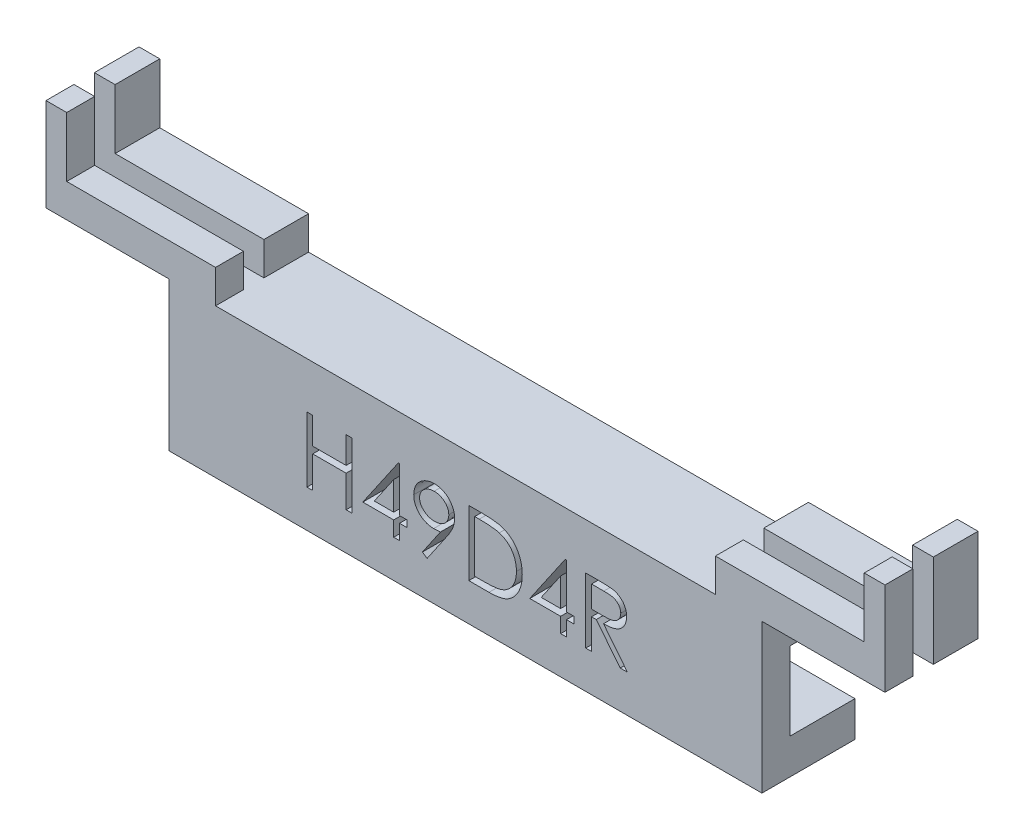
from build123d import *

# Parameters (mm, degrees)
BOSS_EXTRUDE1_DEPTH   = 5
BOSS_EXTRUDE1_2_DEPTH = 5
SKETCH4_W             = 31.87087044
SKETCH4_H             = 8
BOSS_EXTRUDE2_DEPTH   = 5
SKETCH5_W             = 32.67615924
SKETCH5_H             = 4.2
CUT_EXTRUDE1_DEPTH    = 3.5
SKETCH6_W             = 45.1
SKETCH6_H             = 1.1
CUT_EXTRUDE2_DEPTH    = 5
CUT_EXTRUDE4_DEPTH    = 10


with BuildPart() as part:
    # Sketch2 → Boss-Extrude1 (new body)
    with BuildSketch(Plane.XY):
        Polygon((21.435301444, 2.5), (21.435301444, -0.71006712), (13.43543522, -0.71006712), (13.43543522, -2.5), (22.55, -2.5), (22.55, 2.5), align=None)
    extrude(amount=-BOSS_EXTRUDE1_DEPTH)



with BuildPart() as body_2:
    # Sketch2 → Boss-Extrude1 2 (new body)
    with BuildSketch(Plane.XY):
        Polygon((-22.55, 2.5), (-21.435301444, 2.5), (-21.435301444, -0.71006712), (-13.43543522, -0.71006712), (-13.43543522, -2.5), (-22.55, -2.5), align=None)
    extrude(amount=-BOSS_EXTRUDE1_2_DEPTH)


with BuildPart() as part_1:
    add(part.part)

    add(body_2.part)  # Boss-Extrude2 merges body 2
    # Sketch4 → Boss-Extrude2 (add)
    with BuildSketch(Plane.XY):
        with Locations((0, -6.5)):
            Rectangle(SKETCH4_W, SKETCH4_H)
    extrude(amount=-BOSS_EXTRUDE2_DEPTH)

    # Sketch5 → Cut-Extrude1 (cut)
    with BuildSketch(Plane(origin=(0, 0, -5), x_dir=(-1, 0, 0), z_dir=(0, 0, -1))):
        with Locations((0, -6.5)):
            Rectangle(SKETCH5_W, SKETCH5_H)
    extrude(amount=-CUT_EXTRUDE1_DEPTH, mode=Mode.SUBTRACT)

    # Sketch6 → Cut-Extrude2 (cut)
    with BuildSketch(Plane(origin=(0, 2.5, 0), x_dir=(1, 0, 0), z_dir=(0, 1, 0))):
        with Locations((0, 2.05)):
            Rectangle(SKETCH6_W, SKETCH6_H)
    extrude(amount=-CUT_EXTRUDE2_DEPTH, mode=Mode.SUBTRACT)

    # Sketch10 → Cut-Extrude4 (cut)
    # profile 1 of 6: a face of its own
    with BuildSketch(Plane.XY):
        Polygon((-8.525641026, -4.985034776), (-8.211538462, -4.985034776), (-8.211538462, -6.420932211), (-6.416666667, -6.420932211), (-6.416666667, -4.985034776), (-6.102564103, -4.985034776), (-6.102564103, -8.485034776), (-6.416666667, -8.485034776), (-6.416666667, -6.77990657), (-8.211538462, -6.77990657), (-8.211538462, -8.485034776), (-8.525641026, -8.485034776), align=None)
    # profile 2 of 6: a face of its own
    with BuildSketch(Plane.XY):
        Polygon((-3.608673878, -4.895291186), (-3.544871795, -4.895291186), (-3.544871795, -7.318368109), (-3.141025641, -7.318368109), (-3.141025641, -7.677342468), (-3.544871795, -7.677342468), (-3.544871795, -8.485034776), (-3.858974359, -8.485034776), (-3.858974359, -7.677342468), (-5.519230769, -7.677342468), align=None)
        Polygon((-3.858974359, -7.318368109), (-3.858974359, -5.798336058), (-4.90224359, -7.318368109), align=None, mode=Mode.SUBTRACT)
    # profile 3 of 6: a face of its own
    with BuildSketch(Plane.XY):
        with BuildLine():
            Line((-2.064102564, -8.574778365), (-2.315104167, -8.400199038))
            Line((-2.315104167, -8.400199038), (-1.341947115, -6.977622917))
            add(Edge.make_bspline(
                [(-1.341947115, -6.977622917), (-1.404037851, -6.98521598), (-1.526297971, -7.000167145), (-1.649435073, -7.0029138), (-1.710036058, -7.004265545)],
                knots=[0, 0, 0, 0, 1.015715272, 2, 2, 2, 2], degree=3))
            add(Edge.make_bspline(
                [(-1.710036058, -7.004265545), (-1.746778105, -7.003324468), (-1.818899532, -7.001477218), (-1.924931185, -6.986835409), (-2.026816745, -6.964285281), (-2.124286101, -6.930636526), (-2.217705606, -6.888818317), (-2.30687132, -6.836961304), (-2.39166321, -6.775955012), (-2.47117062, -6.706122021), (-2.543482359, -6.629443968), (-2.607905657, -6.548288325), (-2.661446789, -6.461712355), (-2.705923374, -6.371482135), (-2.739653828, -6.276300784), (-2.764216365, -6.177251384), (-2.77933872, -6.073639742), (-2.781137815, -6.003114611), (-2.782051282, -5.96730641)],
                knots=[0, 0, 0, 0, 1.060718605, 2.082097864, 3.085795603, 4.069760067, 5.054557537, 6.03741023, 7.043284206, 8.066802108, 9.088538119, 10.083643548, 11.053783639, 12.022749082, 12.983451788, 13.964007469, 14.966251758, 16, 16, 16, 16], degree=3))
            add(Edge.make_bspline(
                [(-2.782051282, -5.96730641), (-2.780316847, -5.918337757), (-2.776912504, -5.822222226), (-2.749513986, -5.681788457), (-2.704453647, -5.549001913), (-2.64162527, -5.424211719), (-2.562490549, -5.30921298), (-2.467381959, -5.205604371), (-2.356877995, -5.114859517), (-2.233495975, -5.03685544), (-2.100142955, -4.974120442), (-1.960474297, -4.927881142), (-1.815560176, -4.900682394), (-1.717392506, -4.897096533), (-1.66796875, -4.895291186)],
                knots=[0, 0, 0, 0, 1.022988612, 2.007919123, 2.978103895, 3.94594894, 4.918897164, 5.887013414, 6.875921846, 7.89917871, 8.930658928, 9.948724884, 10.967259574, 12, 12, 12, 12], degree=3))
            add(Edge.make_bspline(
                [(-1.66796875, -4.895291186), (-1.61948033, -4.897121349), (-1.523671784, -4.900737579), (-1.382782777, -4.927221548), (-1.24784176, -4.97185822), (-1.119596773, -5.033542784), (-1.000857361, -5.110863692), (-0.89408155, -5.202998216), (-0.801706011, -5.310003743), (-0.72388213, -5.429292233), (-0.66141209, -5.557459214), (-0.616339807, -5.691243137), (-0.588594168, -5.829681858), (-0.585097841, -5.923476332), (-0.583333333, -5.970812019)],
                knots=[0, 0, 0, 0, 1.026385292, 2.028040595, 3.023318987, 4.028184125, 5.03290303, 6.015178782, 7.004435299, 8.016004309, 9.023023918, 10.015172535, 10.998308025, 12, 12, 12, 12], degree=3))
            add(Edge.make_bspline(
                [(-0.583333333, -5.970812019), (-0.584511742, -6.007555786), (-0.58690185, -6.082081327), (-0.603638157, -6.19531167), (-0.632058342, -6.310762899), (-0.664310041, -6.408484495), (-0.695442209, -6.489192945), (-0.72474334, -6.552944525), (-0.757255494, -6.620045788), (-0.795174259, -6.689793126), (-0.835936556, -6.763075661), (-0.881995833, -6.839158377), (-0.932301404, -6.91814337), (-0.968131124, -6.971390458), (-0.986478365, -6.99865657)],
                knots=[0, 0, 0, 0, 1.179839688, 2.393009684, 3.667231171, 4.993948276, 5.694988576, 6.444077775, 7.246288328, 8.089075292, 8.993003841, 9.939041771, 10.944649915, 12, 12, 12, 12], degree=3))
            Line((-0.986478365, -6.99865657), (-2.064102564, -8.574778365))
        make_face()
        with BuildLine():
            add(Edge.make_bspline(
                [(-1.651842949, -6.645291186), (-1.624008935, -6.644530802), (-1.569825572, -6.643050593), (-1.490448273, -6.634041351), (-1.415524069, -6.618067365), (-1.34485282, -6.595147653), (-1.277725918, -6.567490984), (-1.21520959, -6.532278998), (-1.157251514, -6.490262363), (-1.103463587, -6.443052348), (-1.055699588, -6.390601764), (-1.013156557, -6.335704658), (-0.97699599, -6.278120048), (-0.948432712, -6.217126785), (-0.924948137, -6.154209577), (-0.908730125, -6.088355222), (-0.899745792, -6.019906821), (-0.898214217, -5.973408163), (-0.897435897, -5.949778365)],
                knots=[0, 0, 0, 0, 1.163407946, 2.26475976, 3.333800367, 4.359385343, 5.366239384, 6.363380779, 7.350133999, 8.353570782, 9.349036268, 10.310270964, 11.253520213, 12.184142, 13.120487599, 14.056272588, 15.012232024, 16, 16, 16, 16], degree=3))
            add(Edge.make_bspline(
                [(-0.897435897, -5.949778365), (-0.898105567, -5.9261387), (-0.899425232, -5.87955384), (-0.910012532, -5.8110041), (-0.928637755, -5.745310839), (-0.953628239, -5.682114409), (-0.986548477, -5.621934038), (-1.026051963, -5.564014166), (-1.072984413, -5.508722038), (-1.126986979, -5.457358054), (-1.185221532, -5.410010155), (-1.247282032, -5.368224079), (-1.312656948, -5.333202883), (-1.380947438, -5.304303913), (-1.452295787, -5.281752137), (-1.526659775, -5.265534773), (-1.604415181, -5.256563018), (-1.657196467, -5.255041124), (-1.684094551, -5.254265545)],
                knots=[0, 0, 0, 0, 0.972161553, 1.915763587, 2.844109794, 3.775983486, 4.705125789, 5.659731448, 6.655561913, 7.682237399, 8.721216875, 9.739758359, 10.754845918, 11.767244016, 12.7857855, 13.828538656, 14.893392813, 16, 16, 16, 16], degree=3))
            add(Edge.make_bspline(
                [(-1.684094551, -5.254265545), (-1.710758705, -5.255042376), (-1.763073554, -5.256566514), (-1.840137713, -5.265517719), (-1.913998881, -5.281861203), (-1.985140501, -5.304293467), (-2.053428962, -5.333205039), (-2.118800795, -5.368225914), (-2.180875812, -5.410000537), (-2.239054532, -5.457395309), (-2.293152454, -5.508482955), (-2.339277983, -5.564256384), (-2.378871875, -5.621903908), (-2.411746878, -5.682122417), (-2.436749396, -5.745308702), (-2.455371397, -5.811004679), (-2.465959562, -5.879553689), (-2.467279109, -5.926138649), (-2.467948718, -5.949778365)],
                knots=[0, 0, 0, 0, 1.099389452, 2.15699305, 3.192601482, 4.213358962, 5.227959689, 6.245255729, 7.266013209, 8.307253147, 9.336162325, 10.327954924, 11.284637477, 12.215801273, 13.149702402, 14.080068371, 15.025723358, 16, 16, 16, 16], degree=3))
            add(Edge.make_bspline(
                [(-2.467948718, -5.949778365), (-2.467342792, -5.973426564), (-2.466147795, -6.02006514), (-2.454620005, -6.088591533), (-2.435341725, -6.154279727), (-2.409522335, -6.217768434), (-2.375520744, -6.278440292), (-2.333796896, -6.336007654), (-2.28489135, -6.391123104), (-2.229457863, -6.442930316), (-2.168789702, -6.490482492), (-2.103992956, -6.532012874), (-2.036183119, -6.567085318), (-1.965121488, -6.595226702), (-1.891334688, -6.617838366), (-1.814159557, -6.634011911), (-1.733851319, -6.642964178), (-1.679441337, -6.644508075), (-1.651842949, -6.645291186)],
                knots=[0, 0, 0, 0, 0.952633368, 1.87876736, 2.791047057, 3.707742249, 4.635551637, 5.587206343, 6.568248508, 7.601284464, 8.641511608, 9.671105535, 10.699146789, 11.713763218, 12.747829548, 13.806491675, 14.887386225, 16, 16, 16, 16], degree=3))
        make_face(mode=Mode.SUBTRACT)
    # profile 4 of 6: a face of its own
    with BuildSketch(Plane.XY):
        with BuildLine():
            Line((0.179487179, -8.485034776), (0.179487179, -4.985034776))
            Line((0.179487179, -4.985034776), (0.886217949, -4.985034776))
            add(Edge.make_bspline(
                [(0.886217949, -4.985034776), (0.947686937, -4.985477346), (1.066444702, -4.986332388), (1.23805715, -4.99175378), (1.396840912, -5.001344245), (1.542273771, -5.015313772), (1.674754983, -5.032466805), (1.793913591, -5.05396721), (1.900365734, -5.07935538), (1.965835175, -5.10100083), (1.996794872, -5.111236699)],
                knots=[0, 0, 0, 0, 1.314313732, 2.53924729, 3.670748893, 4.714932338, 5.66265055, 6.526160246, 7.303039223, 8, 8, 8, 8], degree=3))
            add(Edge.make_bspline(
                [(1.996794872, -5.111236699), (2.037289611, -5.126667404), (2.117360803, -5.157178898), (2.231367926, -5.2147352), (2.338693289, -5.279948301), (2.439912434, -5.352904164), (2.53271326, -5.435668513), (2.620721157, -5.524725598), (2.700335881, -5.623313938), (2.773244177, -5.729388926), (2.838979836, -5.841700979), (2.896118994, -5.960036087), (2.943572987, -6.083793295), (2.982966214, -6.212628443), (3.014012672, -6.346824821), (3.035194603, -6.486538687), (3.049165593, -6.631217877), (3.050569644, -6.72939234), (3.051282051, -6.779205449)],
                knots=[0, 0, 0, 0, 0.984719456, 1.947108742, 2.898477687, 3.838006223, 4.779231079, 5.722358779, 6.681677486, 7.655904652, 8.64651281, 9.637519902, 10.640069247, 11.656948941, 12.698408672, 13.768548281, 14.867775369, 16, 16, 16, 16], degree=3))
            add(Edge.make_bspline(
                [(3.051282051, -6.779205449), (3.050653084, -6.822466687), (3.049413638, -6.907717476), (3.038284322, -7.033358372), (3.022108002, -7.155271943), (2.997063804, -7.272877643), (2.966661291, -7.387205861), (2.927697139, -7.497038105), (2.883061643, -7.603381915), (2.831011764, -7.704799391), (2.773870379, -7.800882763), (2.712548636, -7.891458291), (2.647111941, -7.975233513), (2.576936308, -8.052462125), (2.502928592, -8.123027703), (2.424604261, -8.187519719), (2.34176121, -8.244676273), (2.254770487, -8.296743382), (2.161094358, -8.342163737), (2.058958492, -8.380593747), (1.947927314, -8.412440362), (1.828273357, -8.439011258), (1.699789879, -8.460088561), (1.562350914, -8.474214953), (1.416167624, -8.483767886), (1.315788359, -8.484604279), (1.264122596, -8.485034776)],
                knots=[0, 0, 0, 0, 1.105936401, 2.179363191, 3.223086493, 4.248585256, 5.251745608, 6.245858792, 7.225916811, 8.198733463, 9.158002045, 10.082870192, 10.993790845, 11.873723703, 12.748670949, 13.606408763, 14.465103618, 15.319838547, 16.196477973, 17.123216899, 18.106603292, 19.147568657, 20.255746949, 21.433717677, 22.679120308, 24, 24, 24, 24], degree=3))
            Line((1.264122596, -8.485034776), (0.179487179, -8.485034776))
        make_face()
        with BuildLine():
            Line((0.493589744, -8.126060417), (0.895332532, -8.126060417))
            add(Edge.make_bspline(
                [(0.895332532, -8.126060417), (0.953060903, -8.12581232), (1.064093701, -8.12533514), (1.223751698, -8.121147937), (1.369631095, -8.114305999), (1.501752604, -8.104730922), (1.620041629, -8.092062306), (1.724745379, -8.077937404), (1.815520637, -8.060339953), (1.870450074, -8.044388993), (1.895833333, -8.037017949)],
                knots=[0, 0, 0, 0, 1.375205317, 2.645023457, 3.804390687, 4.853969522, 5.800190428, 6.637939096, 7.370582563, 8, 8, 8, 8], degree=3))
            add(Edge.make_bspline(
                [(1.895833333, -8.037017949), (1.927781695, -8.02576639), (1.990915334, -8.003532017), (2.081796419, -7.962974356), (2.166553423, -7.914932286), (2.246663449, -7.861530012), (2.320990104, -7.80088401), (2.39041422, -7.734313021), (2.454796022, -7.661478246), (2.51347033, -7.582470085), (2.565978634, -7.497780289), (2.611449863, -7.408241455), (2.651301395, -7.314834645), (2.682579987, -7.216125487), (2.707095572, -7.112996428), (2.72446026, -7.005440215), (2.735274984, -6.893476933), (2.736536432, -6.817324809), (2.737179487, -6.778504327)],
                knots=[0, 0, 0, 0, 0.998632004, 1.973411704, 2.929992603, 3.868527914, 4.809262121, 5.754881198, 6.702106254, 7.672490631, 8.653608572, 9.636854334, 10.631411391, 11.644891563, 12.686317036, 13.754757253, 14.855430412, 16, 16, 16, 16], degree=3))
            add(Edge.make_bspline(
                [(2.737179487, -6.778504327), (2.7366662, -6.737570847), (2.735657842, -6.657156662), (2.722983532, -6.539165967), (2.704461976, -6.425685316), (2.67767829, -6.316707121), (2.643547411, -6.212018769), (2.60095277, -6.112199259), (2.55228615, -6.01619439), (2.494382814, -5.926220024), (2.43096722, -5.841126915), (2.360589341, -5.763171999), (2.284367302, -5.692177699), (2.203132453, -5.627038386), (2.114595354, -5.57037471), (2.020841663, -5.519688029), (1.920495992, -5.476672138), (1.850683296, -5.453793275), (1.815204327, -5.442166186)],
                knots=[0, 0, 0, 0, 1.122418816, 2.205001699, 3.251619955, 4.274784885, 5.280384055, 6.268708349, 7.249350384, 8.229342522, 9.199999885, 10.157847722, 11.105861043, 12.055065948, 13.010012805, 13.98527497, 14.976112212, 16, 16, 16, 16], degree=3))
            add(Edge.make_bspline(
                [(1.815204327, -5.442166186), (1.785853181, -5.434049758), (1.72344459, -5.416792005), (1.621605126, -5.397966633), (1.506989977, -5.381362134), (1.379090276, -5.367304095), (1.238051817, -5.357216773), (1.083766129, -5.349645459), (0.916166524, -5.344538826), (0.79998399, -5.344190119), (0.739683494, -5.344009135)],
                knots=[0, 0, 0, 0, 0.674548936, 1.434276114, 2.292660221, 3.240891867, 4.284742987, 5.42552168, 6.663806718, 8, 8, 8, 8], degree=3))
            Line((0.739683494, -5.344009135), (0.493589744, -5.344009135))
            Line((0.493589744, -5.344009135), (0.493589744, -8.126060417))
        make_face(mode=Mode.SUBTRACT)
    # profile 5 of 6: a face of its own
    with BuildSketch(Plane.XY):
        Polygon((5.365685096, -4.895291186), (5.429487179, -4.895291186), (5.429487179, -7.318368109), (5.833333333, -7.318368109), (5.833333333, -7.677342468), (5.429487179, -7.677342468), (5.429487179, -8.485034776), (5.115384615, -8.485034776), (5.115384615, -7.677342468), (3.455128205, -7.677342468), align=None)
        Polygon((5.115384615, -7.318368109), (5.115384615, -5.798336058), (4.072115385, -7.318368109), align=None, mode=Mode.SUBTRACT)
    # profile 6 of 6: a face of its own
    with BuildSketch(Plane.XY):
        with BuildLine():
            Line((6.461538462, -4.985034776), (7.161959135, -4.985034776))
            add(Edge.make_bspline(
                [(7.161959135, -4.985034776), (7.208700263, -4.985190362), (7.298448408, -4.985489104), (7.427021678, -4.987154867), (7.543848775, -4.991929223), (7.648868614, -4.996037806), (7.742079269, -5.003529747), (7.82376656, -5.010690394), (7.893554257, -5.020064055), (7.935800109, -5.028769478), (7.954927885, -5.032711058)],
                knots=[0, 0, 0, 0, 1.410062039, 2.707475311, 3.878576406, 4.937260626, 5.877586885, 6.699081471, 7.410979367, 8, 8, 8, 8], degree=3))
            add(Edge.make_bspline(
                [(7.954927885, -5.032711058), (7.980534509, -5.039037823), (8.031201498, -5.051556387), (8.104151564, -5.078015987), (8.173665888, -5.108635612), (8.239455713, -5.144599332), (8.301191504, -5.186174112), (8.359509815, -5.232642235), (8.414675278, -5.28374944), (8.464456908, -5.340784282), (8.51139596, -5.400620791), (8.550984586, -5.465324548), (8.585111066, -5.532986076), (8.612281583, -5.604293494), (8.634159556, -5.678555265), (8.649585796, -5.756444062), (8.658836983, -5.837605037), (8.659778839, -5.892962946), (8.66025641, -5.921032372)],
                knots=[0, 0, 0, 0, 1.027469482, 2.033020251, 3.019912614, 3.986113645, 4.951240523, 5.91722682, 6.890402269, 7.87763091, 8.8651537, 9.85103654, 10.82876324, 11.815024772, 12.821070561, 13.842952187, 14.906261191, 16, 16, 16, 16], degree=3))
            add(Edge.make_bspline(
                [(8.66025641, -5.921032372), (8.658787412, -5.967667476), (8.655921016, -6.058664644), (8.629195913, -6.190725526), (8.585419393, -6.31391484), (8.525096104, -6.428077478), (8.448276628, -6.530988124), (8.355951837, -6.621378579), (8.248070226, -6.697018491), (8.14764091, -6.749471296), (8.05892671, -6.783064205), (7.985893397, -6.806700564), (7.90622642, -6.824962529), (7.820689085, -6.841322661), (7.72892543, -6.853674355), (7.63115539, -6.86272095), (7.527309239, -6.868374998), (7.455970169, -6.869217003), (7.419270833, -6.86965016)],
                knots=[0, 0, 0, 0, 1.260483769, 2.459530307, 3.627416485, 4.787058657, 5.939039949, 7.08810263, 8.267026773, 9.491475466, 10.141966685, 10.831826277, 11.566392101, 12.351337768, 13.187381173, 14.07005841, 15.007169909, 16, 16, 16, 16], degree=3))
            Line((7.419270833, -6.86965016), (8.705128205, -8.485034776))
            Line((8.705128205, -8.485034776), (8.316706731, -8.485034776))
            Line((8.316706731, -8.485034776), (7.030849359, -6.86965016))
            Line((7.030849359, -6.86965016), (6.775641026, -6.86965016))
            Line((6.775641026, -6.86965016), (6.775641026, -8.485034776))
            Line((6.775641026, -8.485034776), (6.461538462, -8.485034776))
            Line((6.461538462, -8.485034776), (6.461538462, -4.985034776))
        make_face()
        with BuildLine():
            Line((6.775641026, -5.344009135), (6.775641026, -6.510675801))
            Line((6.775641026, -6.510675801), (7.416466346, -6.515583654))
            add(Edge.make_bspline(
                [(7.416466346, -6.515583654), (7.446386385, -6.51559689), (7.504379942, -6.515622547), (7.588280607, -6.511628771), (7.666400719, -6.507085452), (7.738441471, -6.500136107), (7.804435046, -6.491180035), (7.864348459, -6.479977051), (7.918279511, -6.466924988), (7.98117805, -6.446723362), (8.051414581, -6.414717344), (8.127746041, -6.368151845), (8.192748379, -6.309582726), (8.247666241, -6.24260927), (8.291795672, -6.168973021), (8.322907727, -6.089556652), (8.342650169, -6.006365054), (8.344978715, -5.949186946), (8.346153846, -5.92033125)],
                knots=[0, 0, 0, 0, 1.146690395, 2.22261258, 3.21895312, 4.145990853, 4.996080663, 5.770904154, 6.481378293, 7.121626537, 8.300444488, 9.431385265, 10.535395872, 11.636531494, 12.74115979, 13.810798291, 14.895190096, 16, 16, 16, 16], degree=3))
            add(Edge.make_bspline(
                [(8.346153846, -5.92033125), (8.344951725, -5.892184676), (8.34256956, -5.836408438), (8.323120791, -5.754752527), (8.29023141, -5.677685577), (8.245909172, -5.605521092), (8.191910017, -5.540015356), (8.128592204, -5.483968203), (8.057687009, -5.437718739), (7.991415811, -5.408164358), (7.932181598, -5.390044505), (7.880751938, -5.377293341), (7.82264046, -5.367048872), (7.757565002, -5.358840811), (7.685803371, -5.351785867), (7.60699272, -5.347034088), (7.52165594, -5.344220224), (7.462509009, -5.344081135), (7.431891026, -5.344009135)],
                knots=[0, 0, 0, 0, 1.101028733, 2.181837193, 3.264309656, 4.369019818, 5.486613113, 6.575447106, 7.666700264, 8.788928104, 9.402425223, 10.0903467, 10.862060571, 11.710948788, 12.657782767, 13.684531032, 14.801375019, 16, 16, 16, 16], degree=3))
            Line((7.431891026, -5.344009135), (6.775641026, -5.344009135))
        make_face(mode=Mode.SUBTRACT)
    extrude(amount=-CUT_EXTRUDE4_DEPTH, mode=Mode.SUBTRACT)


with BuildPart() as cut_extrude4_piece_1:
    # of the separate pieces the step leaves, piece 1, a body of its own (cut_extrude4_pieces)
    add(part_1.part.solids().sort_by_distance((21.435301444, 2.5, 0))[0])


with BuildPart() as cut_extrude4_piece_2:
    # of the separate pieces the step leaves, piece 2, a body of its own (cut_extrude4_pieces)
    add(part_1.part.solids().sort_by_distance((0.493589744, -5.344009135, 0))[0])


with BuildPart() as cut_extrude4_piece_3:
    # of the separate pieces the step leaves, piece 3, a body of its own (cut_extrude4_pieces)
    add(part_1.part.solids().sort_by_distance((-2.467948718, -5.949778365, 0))[0])


with BuildPart() as cut_extrude4_piece_4:
    # of the separate pieces the step leaves, piece 4, a body of its own (cut_extrude4_pieces)
    add(part_1.part.solids().sort_by_distance((7.431891026, -5.344009135, 0))[0])


with BuildPart() as cut_extrude4_piece_5:
    # of the separate pieces the step leaves, piece 5, a body of its own (cut_extrude4_pieces)
    add(part_1.part.solids().sort_by_distance((-4.90224359, -7.318368109, 0))[0])


with BuildPart() as cut_extrude4_piece_6:
    # of the separate pieces the step leaves, piece 6, a body of its own (cut_extrude4_pieces)
    add(part_1.part.solids().sort_by_distance((4.072115385, -7.318368109, 0))[0])


solid = Compound([cut_extrude4_piece_1.part, cut_extrude4_piece_2.part, cut_extrude4_piece_3.part, cut_extrude4_piece_4.part, cut_extrude4_piece_5.part, cut_extrude4_piece_6.part])
